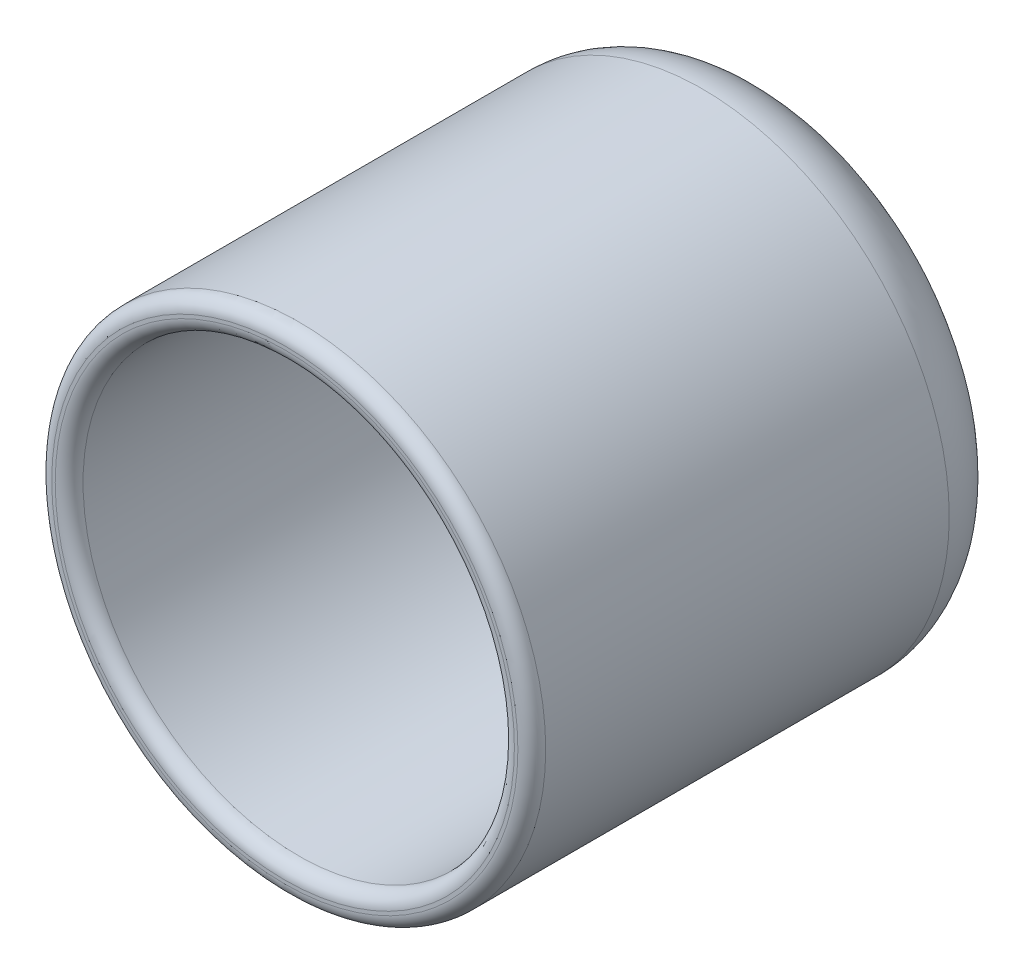
from build123d import *

# Parameters (mm, degrees)
SKETCH1_R           = 3.55
BOSS_EXTRUDE1_DEPTH = 7
SKETCH2_R           = 3.1
CUT_EXTRUDE1_DEPTH  = 6.5
FILLET1_R           = 0.2
FILLET2_R           = 1


with BuildPart() as part:
    # Sketch1 → Boss-Extrude1 (new body)
    with BuildSketch(Plane.XY):
        Circle(SKETCH1_R)
    extrude(amount=BOSS_EXTRUDE1_DEPTH)

    # Sketch2 → Cut-Extrude1 (cut)
    with BuildSketch(Plane.XY.offset(7)):
        Circle(SKETCH2_R)
    extrude(amount=-CUT_EXTRUDE1_DEPTH, mode=Mode.SUBTRACT)

    # Fillet1
    fillet1_edges = [part.edges().sort_by_distance(p)[0] for p in [
        (-3.55, 0, 7),
        (-3.1, 0, 7),
    ]]
    fillet(fillet1_edges, radius=FILLET1_R)

    # Fillet2
    fillet2_edges = [part.edges().sort_by_distance(p)[0] for p in [
        (-3.55, 0, 0),
    ]]
    fillet(fillet2_edges, radius=FILLET2_R)


solid = part.part
